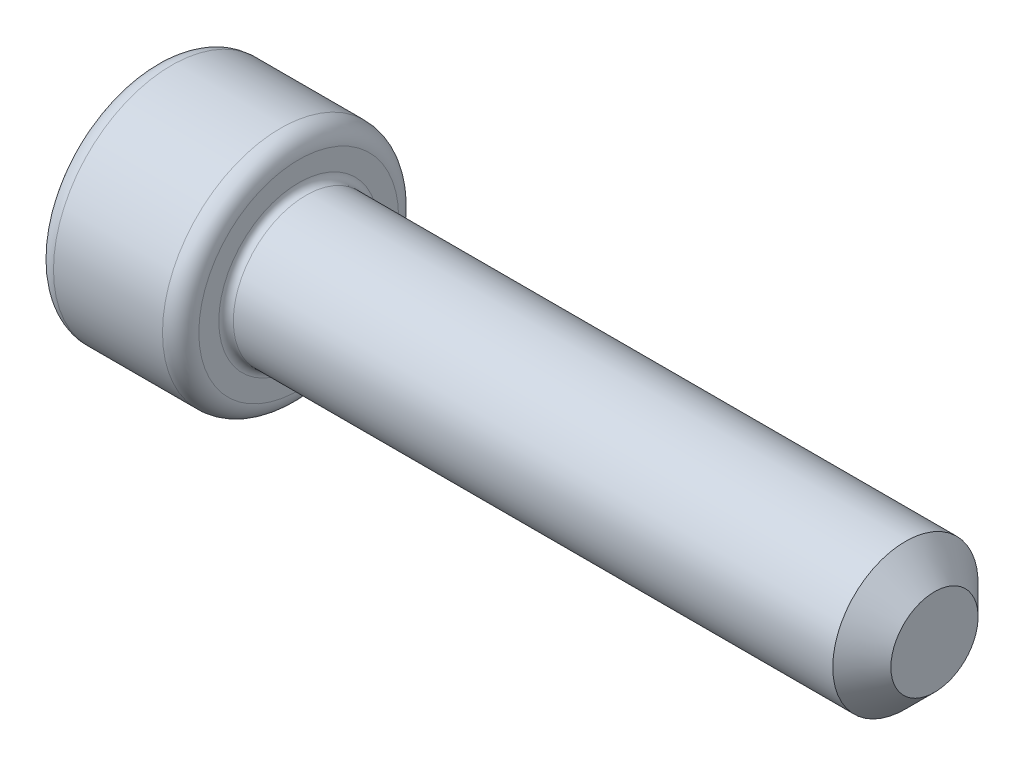
from build123d import *

# Parameters (mm, degrees)
CUT_EXTRUDE_1_DEPTH = 4


with BuildPart() as part:
    # Эскиз1 → Повернуть1 (revolve)
    with BuildSketch(Plane.XY, mode=Mode.PRIVATE) as revolve_1_sk:
        with BuildLine():
            Line((0, 0), (0, 5.5))
            ThreePointArc((0, 5.5), (0.292893219, 6.207106781), (1, 6.5))
            Line((1, 6.5), (7, 6.5))
            ThreePointArc((7, 6.5), (7.707106781, 6.207106781), (8, 5.5))
            Line((8, 5.5), (8, 4.4))
            ThreePointArc((8, 4.4), (8.117157288, 4.117157288), (8.4, 4))
            Line((8.4, 4), (41.4, 4))
            Line((41.4, 4), (43, 2.4))
            Line((43, 2.4), (43, 0))
            Line((43, 0), (0, 0))
        make_face()
    revolve(revolve_1_sk.sketch.rotate(Axis((-7.649504222, 0, 0), (1, 0, 0)), 90), axis=Axis((-7.649504222, 0, 0), (1, 0, 0)))

    # Эскиз2 → Вырез-Вытянуть1 (cut)
    with BuildSketch(Plane.ZY):
        Polygon((0, 3.464101615), (-3, 1.732050808), (-3, -1.732050808), (0, -3.464101615), (3, -1.732050808), (3, 1.732050808), align=None)
    extrude(amount=-CUT_EXTRUDE_1_DEPTH, mode=Mode.SUBTRACT)

    # Вырез-Вытянуть2 cone 1 section (through the dimple's axis) → Вырез-Вытянуть2 (revolve, cut)
    with BuildSketch(Plane.ZX):
        Polygon((0, 0), (3.6, 0), (0, 2.078460969), align=None)
    revolve(axis=Axis((0, 0, 0), (1, 0, 0)), mode=Mode.SUBTRACT)


solid = part.part
